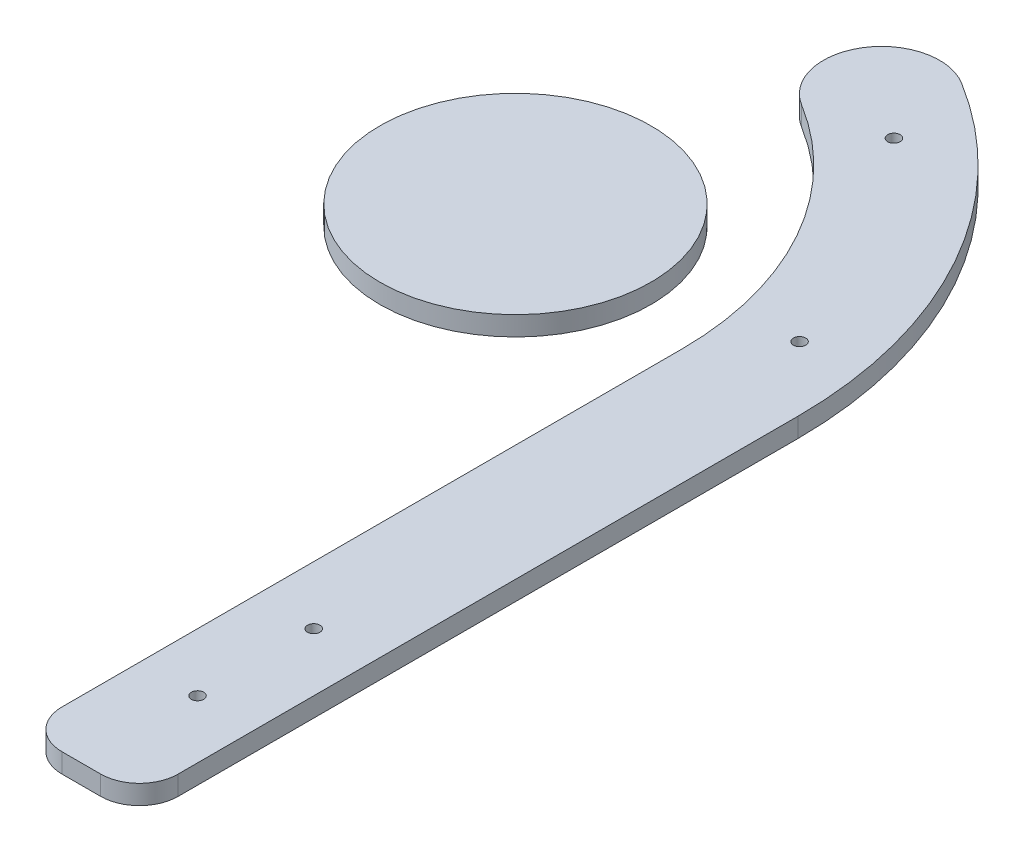
from build123d import *

# Parameters (mm, degrees)
SKETCH_1_R          = 35
EXTRUDE_1_DEPTH     = 5
EXTRUDE_1_2_DEPTH   = 5
SKETCH_2_R          = 1.6
CUT_EXTRUDE_2_DEPTH = 283.295346414
SKETCH_3_R          = 1.6
CUT_EXTRUDE_3_DEPTH = 10


with BuildPart() as part:
    # 草圖1 → 伸長1 (new body)
    with BuildSketch(Plane(origin=(0, 0, 0), x_dir=(1, 0, 0), z_dir=(0, 1, 0))):
        with Locations(Location((-53.914829359, 180.996261194, 0), (0, 0, 270))):
            Circle(SKETCH_1_R)
    extrude(amount=EXTRUDE_1_DEPTH)


with BuildPart() as body_2:
    # 草圖1 → Extrude 1 2 (new body)
    with BuildSketch(Plane(origin=(0, 0, 0), x_dir=(1, 0, 0), z_dir=(0, 1, 0))):
        with BuildLine():
            Line((0, 50), (0, 170))
            ThreePointArc((0, 170), (-10.45393829, 210.151929814), (-39.161133702, 240.107884566))
            ThreePointArc((-39.161133702, 240.107884566), (-44.067899797, 260.745802254), (-23.429982109, 265.652568349))
            ThreePointArc((-23.429982109, 265.652568349), (15.737038666, 224.781787165), (30, 170))
            Line((30, 170), (30, 50))
            Line((30, 50), (30, 10))
            ThreePointArc((30, 10), (27.071067812, 2.928932188), (20, 0))
            Line((20, 0), (10, 0))
            ThreePointArc((10, 0), (2.928932188, 2.928932188), (0, 10))
            Line((0, 10), (0, 50))
        make_face()
    extrude(amount=EXTRUDE_1_2_DEPTH)

    # 草圖2 → 伸長2 (cut, through all)
    with BuildSketch(Plane(origin=(0, 5, 0), x_dir=(1, 0, 0), z_dir=(0, 1, 0))):
        with Locations(Location((15, 60, 0), (0, 0, 270))):
            Circle(SKETCH_2_R)
        with Locations(Location((15, 30, 0), (0, 0, 270))):
            Circle(SKETCH_2_R)
    extrude(amount=-CUT_EXTRUDE_2_DEPTH, mode=Mode.SUBTRACT)

    # 草圖3 → 伸長3 (cut)
    with BuildSketch(Plane(origin=(0, 5, 0), x_dir=(1, 0, 0), z_dir=(0, 1, 0))):
        with Locations(Location((13.52125372, 186.902147325, 0), (0, 0, 270))):
            Circle(SKETCH_3_R)
        with Locations(Location((-19.769477737, 244.56338563, 0), (0, 0, 270))):
            Circle(SKETCH_3_R)
    extrude(amount=-CUT_EXTRUDE_3_DEPTH, mode=Mode.SUBTRACT)


solid = Compound([part.part, body_2.part])
